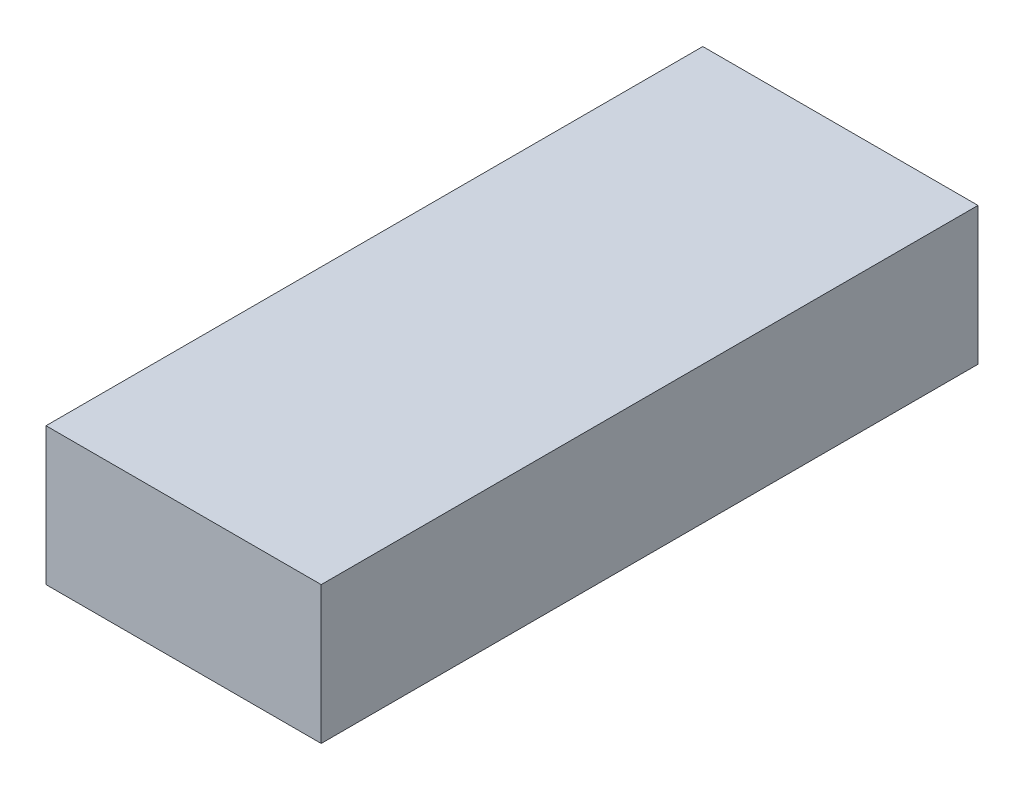
from build123d import *

# Parameters (mm, degrees)
SKETCH1_W           = 60
SKETCH1_H           = 30
BOSS_EXTRUDE1_DEPTH = 71.60006


with BuildPart() as part:
    # Sketch1 → Boss-Extrude1 (new, symmetric)
    with BuildSketch(Plane.XY):
        Rectangle(SKETCH1_W, SKETCH1_H)
    extrude(amount=BOSS_EXTRUDE1_DEPTH, both=True)


solid = part.part
